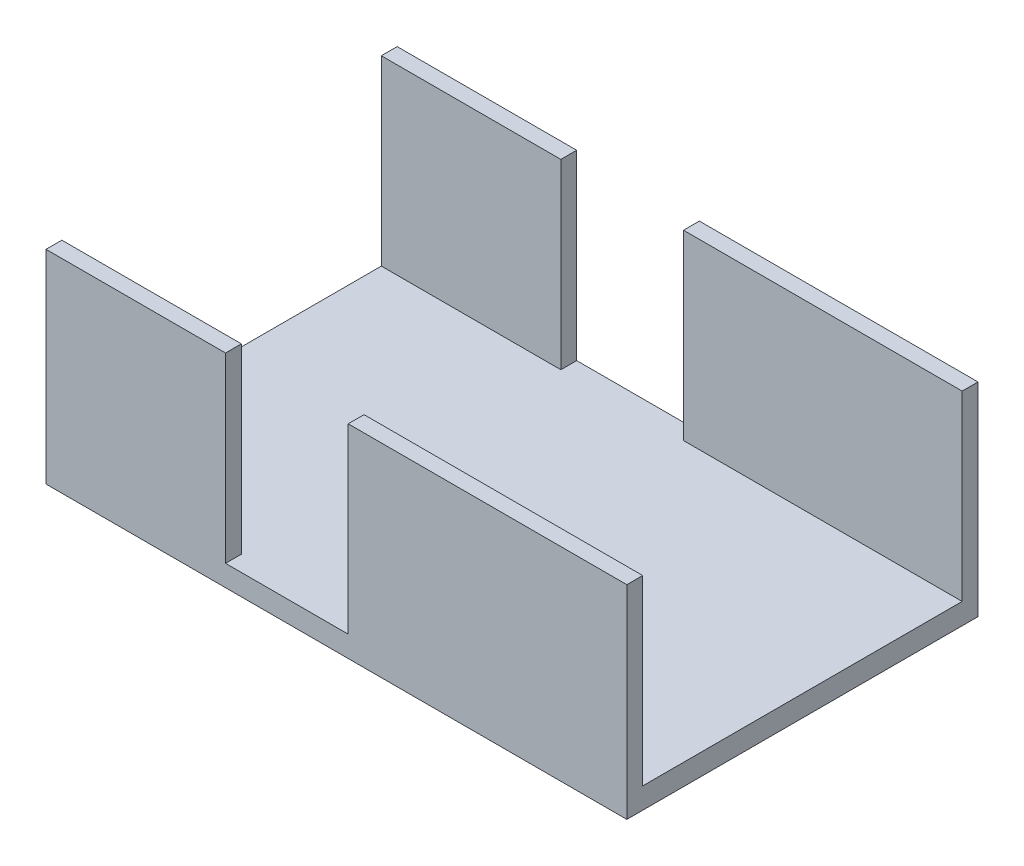
from build123d import *

# Parameters (mm, degrees)
EXTRUDE_1_DEPTH = 4
SKETCH_1_3_W    = 34
SKETCH_1_3_H    = 3
SKETCH_1_3_W_2  = 52.77
EXTRUDE_2_DEPTH = 38.5


with BuildPart() as part:
    # 草图1 → 凸台-拉伸1 (new body)
    with BuildSketch(Plane(origin=(0, 0, 0), x_dir=(1, 0, 0), z_dir=(0, 1, 0))):
        Polygon((0, 63.5), (0, 3), (34, 3), (34, 0), (57.23, 0), (57.23, 3), (110, 3), (110, 63.5), (57.23, 63.5), (57.23, 66.5), (34, 66.5), (34, 63.5), align=None)
    extrude(amount=EXTRUDE_1_DEPTH)

    # 草图1<3> → 凸台-拉伸2 (add)
    with BuildSketch(Plane(origin=(0, 0, 0), x_dir=(1, 0, 0), z_dir=(0, 1, 0))):
        with Locations((17, 1.5)):
            Rectangle(SKETCH_1_3_W, SKETCH_1_3_H)
        with Locations((17, 65)):
            Rectangle(SKETCH_1_3_W, SKETCH_1_3_H)
        with Locations((83.615, 1.5)):
            Rectangle(SKETCH_1_3_W_2, SKETCH_1_3_H)
        with Locations((83.615, 65)):
            Rectangle(SKETCH_1_3_W_2, SKETCH_1_3_H)
    extrude(amount=EXTRUDE_2_DEPTH)


solid = part.part
